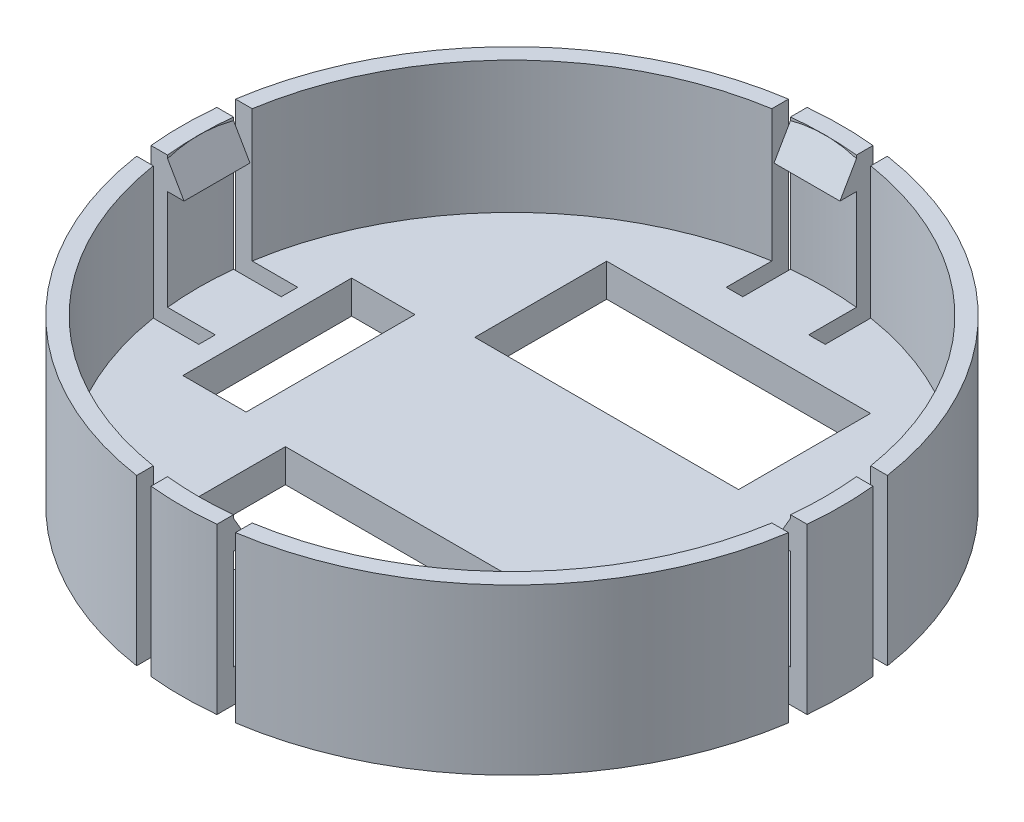
from build123d import *

# Parameters (mm, degrees)
SKETCH1_R           = 15.875
BOSS_EXTRUDE1_DEPTH = 1.5875
BOSS_EXTRUDE2_START = 1.5875
SKETCH1_3_R         = 15.875
SKETCH1_3_R_2       = 15.08125
BOSS_EXTRUDE2_DEPTH = 6.35
CUT_EXTRUDE1_REACH  = 25.812
SKETCH3_W           = 0.79375
SKETCH3_H           = 3.175
BOSS_EXTRUDE3_DEPTH = 1.5875
CIRPATTERN2_COUNT   = 4
SKETCH5_W           = 12.7
SKETCH5_H           = 6.35
SKETCH5_W_2         = 3.048
SKETCH5_H_2         = 8.128
CUT_EXTRUDE2_DEPTH  = 24.3313898


with BuildPart() as part:
    # Sketch1 → Boss-Extrude1 (new body)
    with BuildSketch(Plane(origin=(0, 0, 0), x_dir=(1, 0, 0), z_dir=(0, 1, 0))):
        with Locations(Location((0, 0, 0), (0, 0, 270))):
            Circle(SKETCH1_R)
    extrude(amount=BOSS_EXTRUDE1_DEPTH)

    # Sketch1<3> → Boss-Extrude2 (add)
    with BuildSketch(Plane(origin=(0, 0, 0), x_dir=(1, 0, 0), z_dir=(0, 1, 0)).offset(BOSS_EXTRUDE2_START)):
        with Locations(Location((0, 0, 0), (0, 0, 270))):
            Circle(SKETCH1_3_R)
        with Locations(Location((0, 0, 0), (0, 0, 270))):
            Circle(SKETCH1_3_R_2, mode=Mode.SUBTRACT)
    extrude(amount=BOSS_EXTRUDE2_DEPTH)

    # Cut-Extrude1: up to this face of the body (flat: up to its plane)
    cut_extrude1_end = Plane(part.part.faces().sort_by_distance((0, 0, 0))[0])
    # Sketch3 → Cut-Extrude1 (cut, up to the picked face)
    with BuildSketch(Plane(origin=(0, 7.9375, 0), x_dir=(1, 0, 0), z_dir=(0, 1, 0)), mode=Mode.PRIVATE) as cut_extrude1_sk1:
        with Locations((1.984375, 14.2875)):
            Rectangle(SKETCH3_W, SKETCH3_H)
    cut_extrude1_tool1 = split(extrude(cut_extrude1_sk1.sketch, amount=-CUT_EXTRUDE1_REACH, mode=Mode.PRIVATE), bisect_by=cut_extrude1_end, keep=Keep.BOTH, mode=Mode.PRIVATE)
    # Sketch3 → Cut-Extrude1 (cut, up to the picked face)
    with BuildSketch(Plane(origin=(0, 7.9375, 0), x_dir=(1, 0, 0), z_dir=(0, 1, 0)), mode=Mode.PRIVATE) as cut_extrude1_sk2:
        with Locations((-1.984375, 14.2875)):
            Rectangle(SKETCH3_W, SKETCH3_H)
    cut_extrude1_tool2 = split(extrude(cut_extrude1_sk2.sketch, amount=-CUT_EXTRUDE1_REACH, mode=Mode.PRIVATE), bisect_by=cut_extrude1_end, keep=Keep.BOTH, mode=Mode.PRIVATE)
    cut_extrude1_1 = cut_extrude1_tool1.solids().sort_by(Axis((1.984375, 7.9375, -14.2875), (0, -1, 0)))[0]
    add(cut_extrude1_1, mode=Mode.SUBTRACT)
    cut_extrude1_2 = cut_extrude1_tool2.solids().sort_by(Axis((-1.984375, 7.9375, -14.2875), (0, -1, 0)))[0]
    add(cut_extrude1_2, mode=Mode.SUBTRACT)
    cut_extrude1 = cut_extrude1_1 + cut_extrude1_2  # Cut-Extrude1 as one shape, for the pattern or mirror that repeats it

    # Sketch4 → Boss-Extrude3 (add, symmetric)
    with BuildSketch(Plane.ZY):
        Polygon((-15.795425564, 7.9375), (-15.795425564, 6.4135), (-14.203714629, 6.4135), (-15.08359644, 7.9375), align=None)
    boss_extrude3 = extrude(amount=BOSS_EXTRUDE3_DEPTH, both=True)

    # CirPattern2: Cut-Extrude1, Boss-Extrude3 ×4 about axis
    cirpattern2_axis = Axis((0, 0, 0), (0, 1, 0))
    add([cut_extrude1.rotate(cirpattern2_axis, i * 360 / CIRPATTERN2_COUNT) for i in range(1, CIRPATTERN2_COUNT)], mode=Mode.SUBTRACT)
    add([boss_extrude3.rotate(cirpattern2_axis, i * 360 / CIRPATTERN2_COUNT) for i in range(1, CIRPATTERN2_COUNT)])

    # Sketch5 → Cut-Extrude2 (cut, through all)
    with BuildSketch(Plane(origin=(0, 1.5875, 0), x_dir=(1, 0, 0), z_dir=(0, 1, 0))):
        with Locations((0, 7.7343)):
            Rectangle(SKETCH5_W, SKETCH5_H)
        with Locations((0, -7.7343)):
            Rectangle(SKETCH5_W, SKETCH5_H)
        with Locations((-10.2616, 0)):
            Rectangle(SKETCH5_W_2, SKETCH5_H_2)
    extrude(amount=-CUT_EXTRUDE2_DEPTH, mode=Mode.SUBTRACT)


solid = part.part
